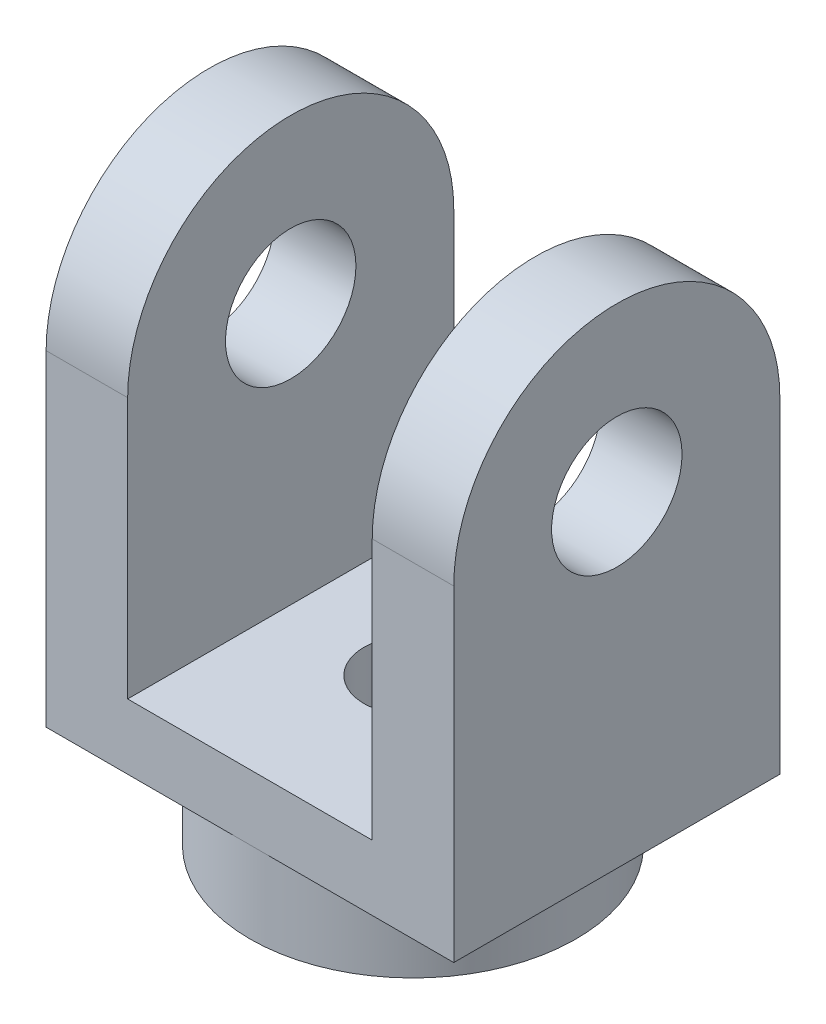
from build123d import *

# Parameters (mm, degrees)
SKETCH1_R               = 50
SKETCH1_R_2             = 37.5
BOSS_EXTRUDE1_DEPTH     = 25
BOSS_EXTRUDE2_DEPTH     = 62.5
CUT_EXTRUDE1_DEPTH      = 191.804219031
CUT_EXTRUDE1_DEPTH_BACK = 191.804219031
SKETCH3_W               = 75
SKETCH3_H               = 130
SKETCH4_R               = 15
CUT_EXTRUDE2_DEPTH      = 153.663846408
SKETCH5_R               = 20
CUT_EXTRUDE3_DEPTH      = 202.556443707


with BuildPart() as part:
    # Sketch1 → Boss-Extrude1 (new body)
    with BuildSketch(Plane(origin=(0, 0, 0), x_dir=(1, 0, 0), z_dir=(0, 1, 0))):
        with Locations(Location((0, 0, 0), (0, 0, 270))):
            Circle(SKETCH1_R)
        with Locations(Location((0, 0, 0), (0, 0, 270))):
            Circle(SKETCH1_R_2, mode=Mode.SUBTRACT)
    extrude(amount=-BOSS_EXTRUDE1_DEPTH)

    # Sketch2 → Boss-Extrude2 (add, symmetric)
    with BuildSketch(Plane(origin=(0, 0, 0), x_dir=(0, 0, -1), z_dir=(1, 0, 0))):
        with BuildLine():
            Line((-50, 0), (50, 0))
            Line((50, 0), (50, 100))
            ThreePointArc((50, 100), (0, 150), (-50, 100))
            Line((-50, 100), (-50, 0))
        make_face()
    extrude(amount=BOSS_EXTRUDE2_DEPTH, both=True)

    # Sketch3 → Cut-Extrude1 (cut, two sides: drawn at the far end of the back side and taken through both)
    with BuildSketch(Plane.XY.offset(50).offset(-CUT_EXTRUDE1_DEPTH_BACK)):
        with Locations((0, 85)):
            Rectangle(SKETCH3_W, SKETCH3_H)
    extrude(amount=CUT_EXTRUDE1_DEPTH + CUT_EXTRUDE1_DEPTH_BACK, mode=Mode.SUBTRACT)

    # Sketch4 → Cut-Extrude2 (cut, through all)
    with BuildSketch(Plane(origin=(0, 20, 0), x_dir=(1, 0, 0), z_dir=(0, 1, 0))):
        with Locations(Location((0, 0, 0), (0, 0, 180))):
            Circle(SKETCH4_R)
    extrude(amount=-CUT_EXTRUDE2_DEPTH, mode=Mode.SUBTRACT)

    # Sketch5 → Cut-Extrude3 (cut, through all)
    with BuildSketch(Plane(origin=(62.5, 0, 0), x_dir=(0, 0, -1), z_dir=(1, 0, 0))):
        with Locations((0, 100)):
            Circle(SKETCH5_R)
    extrude(amount=-CUT_EXTRUDE3_DEPTH, mode=Mode.SUBTRACT)


solid = part.part
